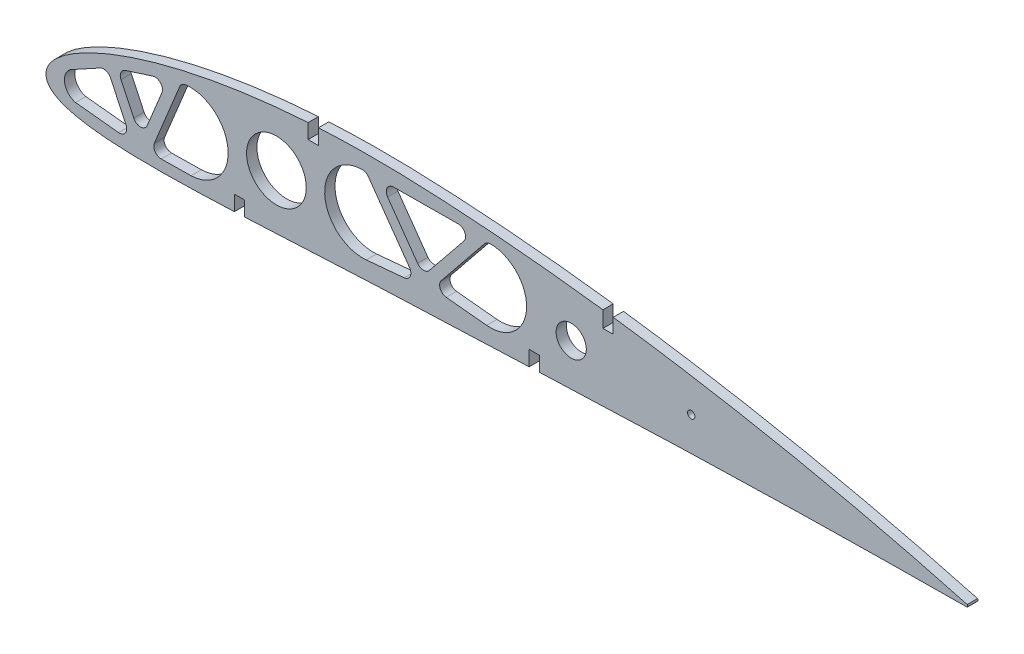
from build123d import *

# Parameters (mm, degrees)
SKETCH_2_R      = 8.1
SKETCH_2_R_2    = 4.1
SKETCH_2_R_3    = 1
EXTRUDE_2_DEPTH = 1.4


with BuildPart() as part:
    # Эскиз2 → Бобышка-Вытянуть2 (new, symmetric)
    with BuildSketch(Plane.XY):
        with BuildLine():
            Line((151.132619318, 20.152925753), (151.132619318, 15.787470759))
            Line((151.132619318, 15.787470759), (153.932619318, 15.787470759))
            Line((153.932619318, 15.787470759), (153.932619318, 19.787470759))
            add(Edge.make_bspline(
                [(250, 0.315), (249.15566774, 0.545019818), (246.720175697, 1.208516241), (242.391332083, 2.35833905), (236.849761203, 3.787625359), (230.779918277, 5.29800883), (224.455917945, 6.812866018), (218.030543493, 8.29161062), (211.562405041, 9.719735042), (205.072411505, 11.092374915), (198.567970908, 12.407850707), (192.052369908, 13.665297902), (185.527619967, 14.864093279), (178.995338985, 16.003404752), (172.457064735, 17.082388086), (165.914317088, 18.099827809), (159.739714866, 19.000386852), (155.744292591, 19.547112651), (153.932619318, 19.787470759)],
                knots=[0, 0, 0, 0, 0.0101622, 0.029313053, 0.052011605, 0.076619468, 0.101948061, 0.127526132, 0.153184131, 0.178867888, 0.204557903, 0.230245712, 0.255925967, 0.281594302, 0.30724642, 0.332878042, 0.358484538, 0.379707003, 0.379707003, 0.379707003, 0.379707003], degree=3))
            ThreePointArc((250, 0.315), (250.130477272, 0), (250, -0.315))
            add(Edge.make_bspline(
                [(133.932619318, -3.149352186), (136.150252366, -3.05984138), (140.66441482, -2.879164577), (147.472013762, -2.613922958), (154.352602411, -2.355626415), (161.225044134, -2.109369921), (168.090869746, -1.876634074), (174.951578522, -1.658643104), (181.808595966, -1.456378123), (188.663234462, -1.270383377), (195.516645168, -1.101112884), (202.369532894, -0.948617189), (211.49919029, -0.767742353), (220.603098666, -0.619939742), (229.617630172, -0.50292618), (236.087353854, -0.431514192), (241.980776913, -0.376520461), (246.558970011, -0.339535886), (249.120490965, -0.321271242), (250, -0.315)],
                knots=[0.541906346, 0.541906346, 0.541906346, 0.541906346, 0.568176028, 0.595379569, 0.622543445, 0.64967326, 0.676775201, 0.703855228, 0.730918775, 0.757971338, 0.785017763, 0.812061651, 0.839103366, 0.893099152, 0.919831065, 0.945809917, 0.969680601, 0.989589706, 1, 1, 1, 1], degree=3))
            Line((133.932619318, -3.149352186), (133.932619318, 0.850647814))
            Line((133.932619318, 0.850647814), (131.132619318, 0.850647814))
            Line((131.132619318, 0.850647814), (131.132619318, -3.262735091))
            add(Edge.make_bspline(
                [(53.932619318, -6.670677263), (55.356569482, -6.605720394), (59.058679651, -6.431131786), (65.052094606, -6.13285227), (71.91077271, -5.784005184), (78.771375577, -5.439680462), (85.61049861, -5.110951262), (92.43210759, -4.804953337), (99.255031191, -4.531981668), (106.097378406, -4.278274685), (112.969211681, -4.003089942), (119.864404255, -3.723176202), (125.92308308, -3.47492717), (129.679854903, -3.321735217), (131.132619318, -3.262735091)],
                knots=[0.225966113, 0.225966113, 0.225966113, 0.225966113, 0.242837762, 0.269833583, 0.296993022, 0.324123272, 0.351139107, 0.378035509, 0.404946016, 0.431960837, 0.459078395, 0.4863474, 0.51364083, 0.530850189, 0.530850189, 0.530850189, 0.530850189], degree=3))
            Line((53.932619318, -6.670677263), (53.932619318, -2.670677263))
            Line((53.932619318, -2.670677263), (51.132619318, -2.670677263))
            Line((51.132619318, -2.670677263), (51.132619318, -6.795360627))
            add(Edge.make_bspline(
                [(0.047975001, 0.621424995), (0.022713821, 0.373490081), (-0.027820788, -0.12249998), (0.077991213, -0.884434595), (0.349695651, -1.638838075), (0.814331136, -2.365068928), (1.463480781, -3.039275249), (2.290973018, -3.660999474), (3.305928751, -4.235779626), (4.53525562, -4.773674148), (6.029745689, -5.282192169), (7.868981216, -5.765316681), (10.168831393, -6.221716597), (13.07543819, -6.639618735), (16.728115364, -6.992956742), (21.189952097, -7.247345149), (26.399984417, -7.376638853), (32.197398565, -7.376256917), (38.39780676, -7.261436583), (44.752137938, -7.05998551), (49.023344092, -6.886827907), (51.132619318, -6.795360627)],
                knots=[0, 0, 0, 0, 0.002941446, 0.005884319, 0.00901613, 0.012364547, 0.016007934, 0.020036845, 0.024573728, 0.029783835, 0.03589701, 0.04324044, 0.052275965, 0.063634589, 0.077983176, 0.095698161, 0.116520086, 0.13966073, 0.16431217, 0.18991889, 0.214908072, 0.214908072, 0.214908072, 0.214908072], degree=3))
            add(Edge.make_bspline(
                [(71.132619318, 24.157469486), (70.635982629, 24.125241372), (68.110579653, 23.953963558), (63.575410502, 23.578006358), (57.555189551, 22.924946655), (51.605762689, 22.119065518), (45.744400312, 21.156564429), (39.995857594, 20.035371386), (34.397919843, 18.75631623), (29.010382104, 17.327615604), (23.925798409, 15.771864917), (19.27067884, 14.13426943), (15.179098392, 12.483335433), (11.740475791, 10.89561099), (8.959371869, 9.429577361), (6.760891181, 8.108603195), (5.033709749, 6.92463805), (3.671694934, 5.85422966), (2.592101124, 4.871305364), (1.738175669, 3.952595739), (1.069870831, 3.080946369), (0.571645411, 2.241622098), (0.2157739, 1.430785392), (0.102255582, 0.88324169), (0.047975001, 0.621424995)],
                knots=[0.701142916, 0.701142916, 0.701142916, 0.701142916, 0.706922144, 0.73053591, 0.7539832, 0.77723469, 0.800246382, 0.822950709, 0.845237155, 0.866915896, 0.887662335, 0.906968281, 0.924203157, 0.938878975, 0.950931611, 0.960693484, 0.968646729, 0.975232933, 0.980794744, 0.985583761, 0.989781539, 0.993521313, 0.996902113, 1, 1, 1, 1], degree=3))
            Line((71.132619318, 24.157469486), (71.132619318, 20.157469486))
            Line((71.132619318, 20.157469486), (73.932619318, 20.157469486))
            Line((73.932619318, 20.157469486), (73.932619318, 24.323871534))
            add(Edge.make_bspline(
                [(151.132619318, 20.152925753), (149.51271539, 20.360855756), (145.712882211, 20.834305053), (139.731359791, 21.525676112), (133.19183673, 22.212004248), (126.658683026, 22.825721427), (120.136770918, 23.363973264), (113.62856714, 23.824677322), (107.152732037, 24.200242592), (100.741095693, 24.498399508), (94.411752715, 24.686649766), (88.155917993, 24.740095648), (81.949043055, 24.658849141), (77.212383792, 24.491578654), (74.545027167, 24.35694527), (73.932619318, 24.323871534)],
                knots=[0.390637302, 0.390637302, 0.390637302, 0.390637302, 0.409602822, 0.435103874, 0.460559416, 0.485959195, 0.51130307, 0.536551515, 0.561723366, 0.586628867, 0.611085431, 0.6352512, 0.659272176, 0.683163753, 0.690285585, 0.690285585, 0.690285585, 0.690285585], degree=3))
        make_face()
        with Locations((62.532619318, 8.596197208)):
            Circle(SKETCH_2_R, mode=Mode.SUBTRACT)
        with Locations((142.532619318, 8.596197208)):
            Circle(SKETCH_2_R_2, mode=Mode.SUBTRACT)
        with Locations((175.091334091, 7.493910357)):
            Circle(SKETCH_2_R_3, mode=Mode.SUBTRACT)
        with BuildLine():
            Line((87.496942629, 19.59683512), (98.656957359, 3.846404038))
            ThreePointArc((98.656957359, 3.846404038), (98.841412786, 1.852917443), (97.205894504, 0.698321168))
            Line((97.205894504, 0.698321168), (86.928494978, -0.234664059))
            ThreePointArc((86.928494978, -0.234664059), (75.647085804, 9.534937552), (85.834710285, 20.440331448))
            ThreePointArc((85.834710285, 20.440331448), (86.770100886, 20.22407123), (87.496942629, 19.59683512))
        make_face(mode=Mode.SUBTRACT)
        with BuildLine():
            Line((107.26658781, 5.068960843), (119.042711354, 19.640469699))
            ThreePointArc((119.042711354, 19.640469699), (119.738361249, 20.189071191), (120.602738696, 20.383349351))
            ThreePointArc((120.602738696, 20.383349351), (130.419922424, 10.031300237), (119.603876283, 0.727797506))
            Line((119.603876283, 0.727797506), (108.623842739, 1.821697682))
            ThreePointArc((108.623842739, 1.821697682), (106.976814232, 3.040567769), (107.26658781, 5.068960843))
        make_face(mode=Mode.SUBTRACT)
        with BuildLine():
            Line((92.710261403, 17.428221559), (100.847534604, 5.943867476))
            ThreePointArc((100.847534604, 5.943867476), (102.41617089, 5.101141005), (104.034940499, 5.843025535))
            Line((104.034940499, 5.843025535), (113.413576859, 17.447937989))
            ThreePointArc((113.413576859, 17.447937989), (113.659822033, 19.573166514), (111.84428559, 20.7050059))
            Line((111.84428559, 20.7050059), (94.32837603, 20.584447529))
            ThreePointArc((94.32837603, 20.584447529), (92.562400415, 19.496921566), (92.710261403, 17.428221559))
        make_face(mode=Mode.SUBTRACT)
        with BuildLine():
            Line((17.488708089, 7.868002897), (21.725441093, -1.073266618))
            ThreePointArc((21.725441093, -1.073266618), (21.549996986, -3.085882804), (19.709418924, -3.918755509))
            Line((19.709418924, -3.918755509), (7.999391348, -2.690370853))
            ThreePointArc((7.999391348, -2.690370853), (5.078852056, 0.362162442), (6.580135706, 4.311042875))
            Line((6.580135706, 4.311042875), (14.721240391, 8.766081587))
            ThreePointArc((14.721240391, 8.766081587), (16.29867531, 8.913940332), (17.488708089, 7.868002897))
        make_face(mode=Mode.SUBTRACT)
        with BuildLine():
            Line((29.401621993, -1.567898965), (36.28872379, 15.177681436))
            ThreePointArc((36.28872379, 15.177681436), (36.93262885, 16.01260855), (37.911651949, 16.404055587))
            ThreePointArc((37.911651949, 16.404055587), (49.40696202, 6.85120019), (39.366777065, -4.221012142))
            Line((39.366777065, -4.221012142), (31.277857225, -4.328453595))
            ThreePointArc((31.277857225, -4.328453595), (29.59717908, -3.452864074), (29.401621993, -1.567898965))
        make_face(mode=Mode.SUBTRACT)
        with BuildLine():
            Line((20.342244628, 8.85190119), (23.813024955, 1.527110532))
            ThreePointArc((23.813024955, 1.527110532), (25.672695714, 0.384197539), (27.470064023, 1.622782457))
            Line((27.470064023, 1.622782457), (31.461008962, 11.326528867))
            ThreePointArc((31.461008962, 11.326528867), (31.082028751, 13.44264333), (29.003823035, 13.992759157))
            Line((29.003823035, 13.992759157), (21.542097769, 11.613803404))
            ThreePointArc((21.542097769, 11.613803404), (20.315234657, 10.50521233), (20.342244628, 8.85190119))
        make_face(mode=Mode.SUBTRACT)
    extrude(amount=EXTRUDE_2_DEPTH, both=True)


solid = part.part
